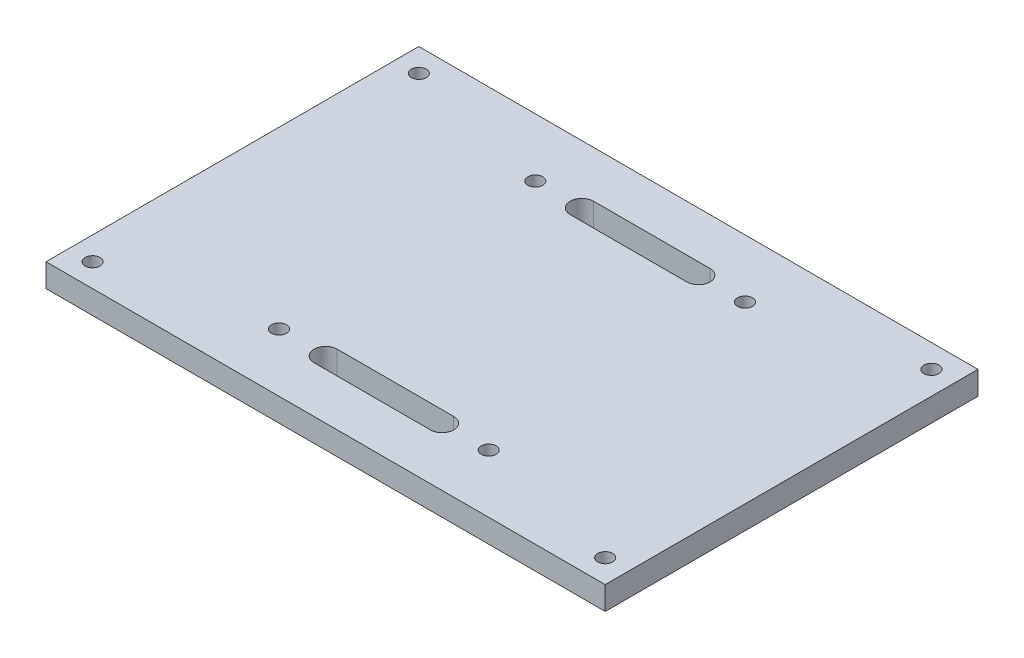
from build123d import *

# Parameters (mm, degrees)
ESQUISSE1_W             = 120
ESQUISSE1_H             = 80
BOSS_EXTRU_1_DEPTH      = 5
ESQUISSE2_R             = 1.6
ENL_V_MAT_EXTRU_1_DEPTH = 145.308696897


with BuildPart() as part:
    # Esquisse1 → Boss.-Extru.1 (new body)
    with BuildSketch(Plane(origin=(0, 0, 0), x_dir=(1, 0, 0), z_dir=(0, 1, 0))):
        with Locations((60, 40)):
            Rectangle(ESQUISSE1_W, ESQUISSE1_H)
    extrude(amount=BOSS_EXTRU_1_DEPTH)

    # Esquisse2 → Enlèv. mat.-Extru.1 (cut, through all)
    with BuildSketch(Plane(origin=(0, 5, 0), x_dir=(1, 0, 0), z_dir=(0, 1, 0))):
        with Locations(Location((37.5, 67.5, 0), (0, 0, 270))):
            Circle(ESQUISSE2_R)
        with Locations(Location((82.5, 67.5, 0), (0, 0, 90))):
            Circle(ESQUISSE2_R)
        with Locations(Location((82.5, 12.5, 0), (0, 0, 270))):
            Circle(ESQUISSE2_R)
        with Locations(Location((37.5, 12.5, 0), (0, 0, 90))):
            Circle(ESQUISSE2_R)
        with Locations(Location((5, 75, 0), (0, 0, 270))):
            Circle(ESQUISSE2_R)
        with Locations(Location((115, 75, 0), (0, 0, 90))):
            Circle(ESQUISSE2_R)
        with Locations(Location((115, 5, 0), (0, 0, 270))):
            Circle(ESQUISSE2_R)
        with Locations(Location((5, 5, 0), (0, 0, 90))):
            Circle(ESQUISSE2_R)
        with BuildLine():
            Line((47.5, 70), (72.5, 70))
            ThreePointArc((72.5, 70), (75, 67.5), (72.5, 65))
            Line((72.5, 65), (47.5, 65))
            ThreePointArc((47.5, 65), (45, 67.5), (47.5, 70))
        make_face()
        with BuildLine():
            Line((47.5, 10), (72.5, 10))
            ThreePointArc((72.5, 10), (75, 12.5), (72.5, 15))
            Line((72.5, 15), (47.5, 15))
            ThreePointArc((47.5, 15), (45, 12.5), (47.5, 10))
        make_face()
    extrude(amount=-ENL_V_MAT_EXTRU_1_DEPTH, mode=Mode.SUBTRACT)


solid = part.part
